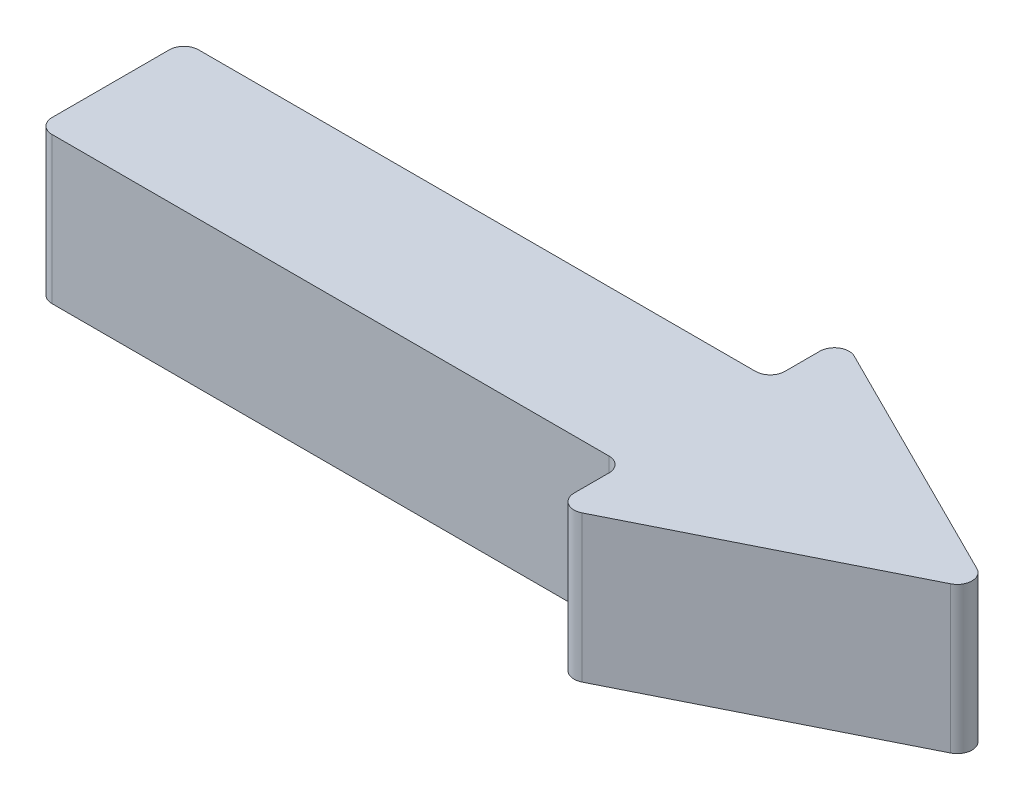
from build123d import *

# Parameters (mm, degrees)
SKETCH1_W           = 25.4
SKETCH1_H           = 3.175
BOSS_EXTRUDE1_DEPTH = 6.35
SKETCH2_R           = 2.4003
CUT_EXTRUDE1_DEPTH  = 8.89
FILLET1_R           = 0.635
CUT_EXTRUDE2_DEPTH  = 3.81


with BuildPart() as part:
    # Sketch1 → Boss-Extrude1 (new body)
    with BuildSketch(Plane(origin=(0, 0, 0), x_dir=(1, 0, 0), z_dir=(0, 1, 0))):
        with Locations((12.7, 4.7625)):
            Rectangle(SKETCH1_W, SKETCH1_H)
        with Locations((12.7, 1.5875)):
            Rectangle(SKETCH1_W, SKETCH1_H)
        Polygon((25.4, 6.35), (25.4, 3.175), (38.1, 3.175), (25.4, 9.525), align=None)
        Polygon((38.1, 3.175), (25.4, 3.175), (25.4, 0), (25.4, -3.175), align=None)
    extrude(amount=BOSS_EXTRUDE1_DEPTH)

    # Sketch2 → Cut-Extrude1 (cut)
    with BuildSketch(Plane.ZY):
        with Locations((-3.175, 3.175)):
            Circle(SKETCH2_R)
    extrude(amount=-CUT_EXTRUDE1_DEPTH, mode=Mode.SUBTRACT)

    # Fillet1
    fillet1_edges = [part.edges().sort_by_distance(p)[0] for p in [
        (0, 3.175, -6.35),
        (25.4, 3.175, -6.35),
        (25.4, 3.175, -9.525),
        (38.1, 3.175, -3.175),
        (25.4, 3.175, 3.175),
        (25.4, 3.175, 0),
        (0, 3.175, 0),
    ]]
    fillet(fillet1_edges, radius=FILLET1_R)

    # Sketch3 → Cut-Extrude2 (cut)
    with BuildSketch(Plane.XZ):
        with BuildLine():
            ThreePointArc((11.926548417, -3.175), (11.037548417, -2.286), (10.148548417, -3.175))
            Line((10.148548417, -3.175), (11.926548417, -3.175))
        make_face()
        with BuildLine():
            Line((11.926548417, -3.175), (10.148548417, -3.175))
            ThreePointArc((10.148548417, -3.175), (11.037548417, -4.064), (11.926548417, -3.175))
        make_face()
        with BuildLine():
            ThreePointArc((27.166548417, -3.175), (26.277548417, -2.286), (25.388548417, -3.175))
            Line((25.388548417, -3.175), (27.166548417, -3.175))
        make_face()
        with BuildLine():
            Line((27.166548417, -3.175), (25.388548417, -3.175))
            ThreePointArc((25.388548417, -3.175), (26.277548417, -4.064), (27.166548417, -3.175))
        make_face()
    extrude(amount=-CUT_EXTRUDE2_DEPTH, mode=Mode.SUBTRACT)


solid = part.part
